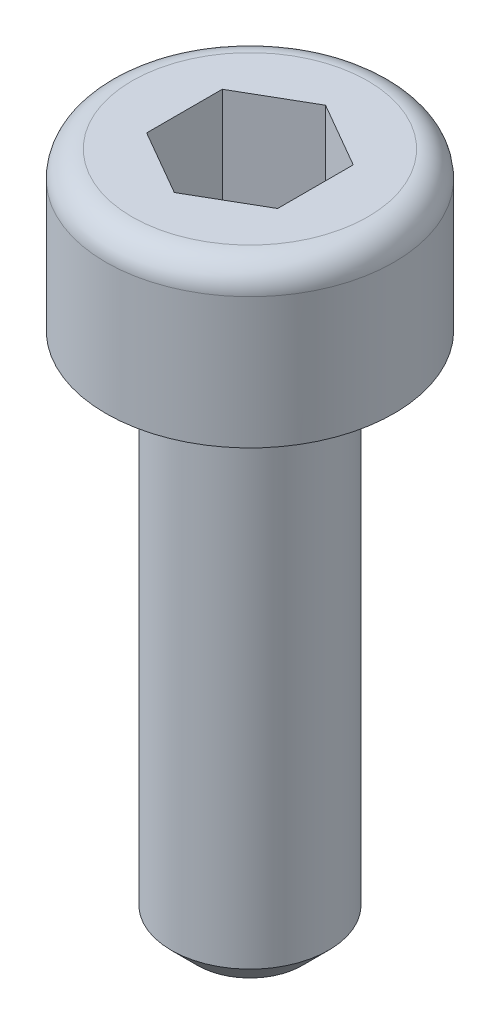
from build123d import *

# Parameters (mm, degrees)
CORTAR_EXTRUIR1_DEPTH = 2
CHAFL_N1_SIZE         = 0.5
REDONDEO1_R           = 0.5


with BuildPart() as part:
    # Croquis1 → Revolución1 (revolve)
    with BuildSketch(Plane.XY, mode=Mode.PRIVATE) as revoluci_n1_sk:
        Polygon((0, 0), (2.75, 0), (2.75, -3), (1.5, -3), (1.5, -13), (0, -13), align=None)
    revolve(revoluci_n1_sk.sketch.rotate(Axis((0, 0, 0), (0, -1, 0)), 90), axis=Axis((0, 0, 0), (0, -1, 0)))

    # Croquis2 → Cortar-Extruir1 (cut)
    with BuildSketch(Plane(origin=(0, 0, 0), x_dir=(1, 0, 0), z_dir=(0, 1, 0))):
        Polygon((1.25, 0.721687836), (0, 1.443375673), (-1.25, 0.721687836), (-1.25, -0.721687836), (0, -1.443375673), (1.25, -0.721687836), align=None)
    extrude(amount=-CORTAR_EXTRUIR1_DEPTH, mode=Mode.SUBTRACT)

    # Chaflán1
    chafl_n1_edges = [part.edges().sort_by_distance(p)[0] for p in [
        (0, -13, -1.5),
    ]]
    chamfer(chafl_n1_edges, length=CHAFL_N1_SIZE)

    # Redondeo1
    redondeo1_edges = [part.edges().sort_by_distance(p)[0] for p in [
        (0, 0, -2.75),
    ]]
    fillet(redondeo1_edges, radius=REDONDEO1_R)


solid = part.part
